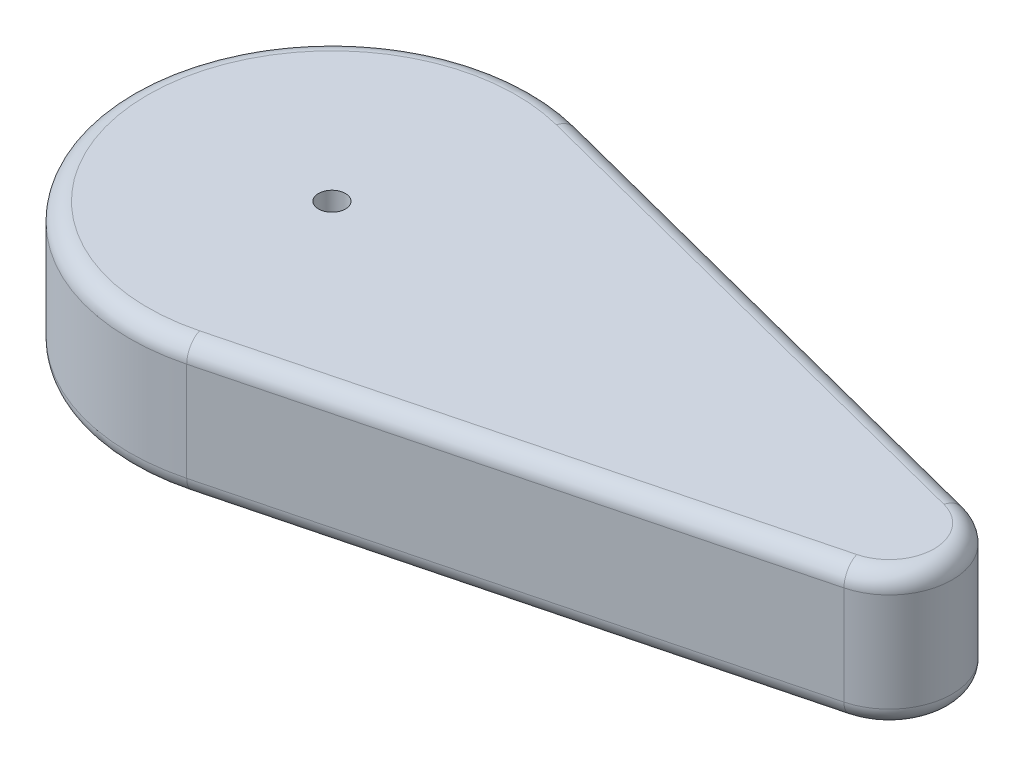
from build123d import *

# Parameters (mm, degrees)
SKETCH1_R               = 1.5
CAM_DEPTH               = 15
CAM_FILLET_2MM_R        = 2
SERVO_ADAPTER_CUT_DEPTH = 7
FILLET_4_5MM_R          = 4


with BuildPart() as part:
    # Sketch1 → Cam (new body)
    with BuildSketch(Plane(origin=(0, 0, 0), x_dir=(1, 0, 0), z_dir=(0, 1, 0))):
        with BuildLine():
            ThreePointArc((5.625, 21.785531322), (-22.5, 0), (5.625, -21.785531322))
            Line((5.625, -21.785531322), (63.75, -6.777720856))
            ThreePointArc((63.75, -6.777720856), (69, 0), (63.75, 6.777720856))
            Line((63.75, 6.777720856), (5.625, 21.785531322))
        make_face()
        with Locations(Location((0, 0, 0), (0, 0, 270))):
            Circle(SKETCH1_R, mode=Mode.SUBTRACT)
    extrude(amount=CAM_DEPTH)

    # Cam_Fillet_2mm
    cam_fillet_2mm_edges = [part.edges().sort_by_distance(p)[0] for p in [
        (34.6875, 15, -14.281626089),
        (-22.5, 15, 0),
        (34.6875, 15, 14.281626089),
        (69, 15, 0),
        (34.6875, 0, 14.281626089),
        (-22.5, 0, 0),
        (34.6875, 0, -14.281626089),
        (69, 0, 0),
    ]]
    fillet(cam_fillet_2mm_edges, radius=CAM_FILLET_2MM_R)

    # Sketch2 → Servo_adapter_cut (cut)
    with BuildSketch(Plane.XZ):
        with BuildLine():
            Line((0, 1.5), (0, 4.5))
            Line((0, 4.5), (6.614378278, 4.5))
            ThreePointArc((6.614378278, 4.5), (-8, 0), (6.614378278, -4.5))
            Line((6.614378278, -4.5), (0, -4.5))
            Line((0, -4.5), (0, -1.5))
            ThreePointArc((0, -1.5), (-1.5, 0), (0, 1.5))
        make_face()
        with BuildLine():
            Line((6.614378278, 4.5), (0, 4.5))
            Line((0, 4.5), (0, 1.5))
            ThreePointArc((0, 1.5), (1.060660172, 1.060660172), (1.5, 0))
            ThreePointArc((1.5, 0), (1.060660172, -1.060660172), (0, -1.5))
            Line((0, -1.5), (0, -4.5))
            Line((0, -4.5), (6.614378278, -4.5))
            ThreePointArc((6.614378278, -4.5), (7.645751311, -2.354248689), (8, 0))
            ThreePointArc((8, 0), (7.645751311, 2.354248689), (6.614378278, 4.5))
        make_face()
        with BuildLine():
            Line((27.5, 4.5), (6.614378278, 4.5))
            ThreePointArc((6.614378278, 4.5), (7.645751311, 2.354248689), (8, 0))
            ThreePointArc((8, 0), (7.645751311, -2.354248689), (6.614378278, -4.5))
            Line((6.614378278, -4.5), (27.5, -4.5))
            Line((27.5, -4.5), (27.5, 4.5))
        make_face()
    extrude(amount=-SERVO_ADAPTER_CUT_DEPTH, mode=Mode.SUBTRACT)

    # Fillet_4.5mm
    fillet_4_5mm_edges = [part.edges().sort_by_distance(p)[0] for p in [
        (6.614378278, 3.5, -4.5),
        (6.614378278, 3.5, 4.5),
        (27.5, 3.5, 4.5),
        (27.5, 3.5, -4.5),
    ]]
    fillet(fillet_4_5mm_edges, radius=FILLET_4_5MM_R)


solid = part.part
